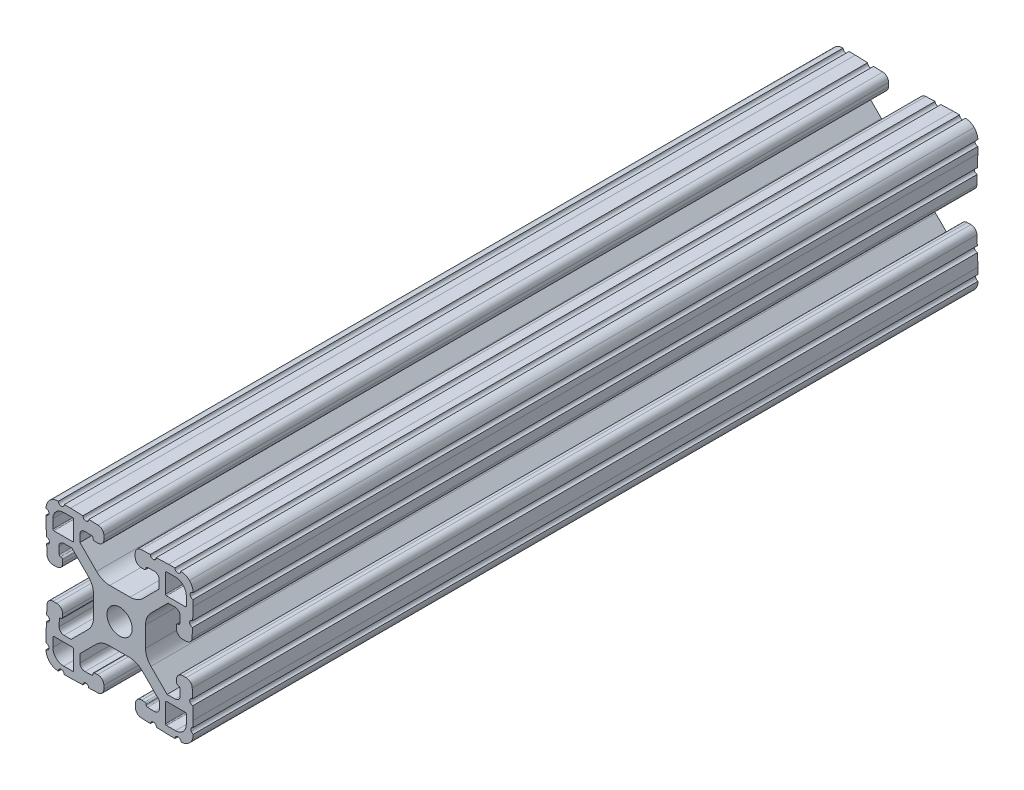
from build123d import *

# Parameters (mm, degrees)
SKETCH1_R           = 3.2639
BOSS_EXTRUDE1_DEPTH = 203.2


with BuildPart() as part:
    # Sketch1 → Boss-Extrude1 (new body)
    with BuildSketch(Plane(origin=(0, 0, -25.4), x_dir=(-1, 0, 0), z_dir=(0, 0, -1))):
        with BuildLine():
            Line((-88.043721549, 91.862643967), (-86.29674679, 91.923648859))
            ThreePointArc((-86.29674679, 91.923648859), (-85.370208675, 91.567983831), (-84.982425017, 90.654422489))
            Line((-84.982425017, 90.654422489), (-84.982425017, 88.800173916))
            Line((-84.982425017, 88.800173916), (-89.306565884, 84.476033049))
            ThreePointArc((-89.306565884, 84.476033049), (-90.866149908, 83.406077005), (-92.719610366, 83.029523439))
            Line((-92.719610366, 83.029523439), (-97.961628589, 83.029523439))
            ThreePointArc((-97.961628589, 83.029523439), (-99.779298356, 83.391080435), (-101.320244378, 84.42070765))
            Line((-101.320244378, 84.42070765), (-105.516001761, 88.616465033))
            Line((-105.516001761, 88.616465033), (-105.516001761, 90.731330035))
            ThreePointArc((-105.516001761, 90.731330035), (-105.128218103, 91.644891377), (-104.201679988, 92.000556406))
            Line((-104.201679988, 92.000556406), (-102.454705229, 91.939551513))
            ThreePointArc((-102.454705229, 91.939551513), (-102.193933359, 91.823448504), (-102.087001761, 91.558783602))
            ThreePointArc((-102.087001761, 91.558783602), (-102.010859042, 91.249291513), (-101.726191901, 91.105946874))
            Line((-101.726191901, 91.105946874), (-100.929727576, 91.078102142))
            ThreePointArc((-100.929727576, 91.078102142), (-99.780779944, 91.519102656), (-99.299905511, 92.651940638))
            Line((-99.299905511, 92.651940638), (-99.299905511, 93.566848638))
            ThreePointArc((-99.299905511, 93.566848638), (-99.741889517, 94.660796975), (-100.819746715, 95.140689345))
            Line((-100.819746715, 95.140689345), (-103.211918901, 95.224224422))
            ThreePointArc((-103.211918901, 95.224224422), (-104.000045777, 94.489281495), (-104.734990687, 95.277406522))
            Line((-104.734990687, 95.277406522), (-107.935905676, 95.389166912))
            Line((-107.935905676, 95.389166912), (-109.561454876, 95.389166912))
            ThreePointArc((-109.561454876, 95.389166912), (-110.323454876, 94.627166912), (-111.085454876, 95.389166912))
            ThreePointArc((-111.085454876, 95.389166912), (-112.308767787, 95.144035599), (-113.343184761, 94.446493225))
            ThreePointArc((-113.343184761, 94.446493225), (-114.04072548, 93.412075135), (-114.285854836, 92.188761832))
            ThreePointArc((-114.285854836, 92.188761832), (-113.523853616, 91.426762441), (-114.285853616, 90.664761832))
            Line((-114.285853616, 90.664761832), (-114.285853616, 89.039212632))
            Line((-114.285853616, 89.039212632), (-114.174093219, 85.838297643))
            ThreePointArc((-114.174093219, 85.838297643), (-113.385968191, 85.103352735), (-114.120911115, 84.315225857))
            Line((-114.120911115, 84.315225857), (-114.037376031, 81.923053667))
            ThreePointArc((-114.037376031, 81.923053667), (-113.55748366, 80.845196472), (-112.463535325, 80.403212468))
            Line((-112.463535325, 80.403212468), (-111.548627325, 80.403212468))
            ThreePointArc((-111.548627325, 80.403212468), (-110.415788905, 80.884087354), (-109.974788872, 82.033035791))
            Line((-109.974788872, 82.033035791), (-110.002634241, 82.829500094))
            ThreePointArc((-110.002634241, 82.829500094), (-110.118742417, 83.090261917), (-110.383401914, 83.197188))
            ThreePointArc((-110.383401914, 83.197188), (-110.693757401, 83.272605688), (-110.837665276, 83.557735272))
            Line((-110.837665276, 83.557735272), (-110.898671566, 85.304709982))
            ThreePointArc((-110.898671566, 85.304709982), (-110.543006925, 86.231248747), (-109.62944523, 86.61903277))
            Line((-109.62944523, 86.61903277), (-107.807161806, 86.61903277))
            Line((-107.807161806, 86.61903277), (-103.364925613, 82.176810793))
            ThreePointArc((-103.364925613, 82.176810793), (-102.335294479, 80.635862907), (-101.973736029, 78.81818963))
            Line((-101.973736029, 78.81818963), (-101.973736029, 73.576034207))
            ThreePointArc((-101.973736029, 73.576034207), (-102.335293752, 71.758362684), (-103.364922926, 70.21741573))
            Line((-103.364922926, 70.21741573), (-107.560683666, 66.021661704))
            Line((-107.560683666, 66.021661704), (-109.652436558, 66.021661704))
            ThreePointArc((-109.652436558, 66.021661704), (-110.565998503, 66.409445617), (-110.921663765, 67.335984343))
            Line((-110.921663765, 67.335984343), (-110.860658873, 69.082959102))
            ThreePointArc((-110.860658873, 69.082959102), (-110.744555864, 69.343730973), (-110.479890961, 69.45066257))
            ThreePointArc((-110.479890961, 69.45066257), (-110.173494703, 69.529390272), (-110.032185196, 69.812424443))
            Line((-110.032185196, 69.812424443), (-110.004340464, 70.608888768))
            ThreePointArc((-110.004340464, 70.608888768), (-110.445340978, 71.7578364), (-111.57817896, 72.238710833))
            Line((-111.57817896, 72.238710833), (-112.49308696, 72.238710833))
            ThreePointArc((-112.49308696, 72.238710833), (-113.587035297, 71.796726827), (-114.066927667, 70.718869629))
            Line((-114.066927667, 70.718869629), (-114.150462744, 68.326697443))
            ThreePointArc((-114.150462744, 68.326697443), (-113.415519817, 67.538570567), (-114.203644843, 66.803625657))
            Line((-114.203644843, 66.803625657), (-114.315405233, 63.602710668))
            Line((-114.315405233, 63.602710668), (-114.315405233, 61.962557497))
            ThreePointArc((-114.315405233, 61.962557497), (-113.701927281, 61.206106537), (-114.333208228, 60.464447842))
            ThreePointArc((-114.333208228, 60.464447842), (-114.113020459, 59.176546471), (-113.392816136, 58.086372941))
            ThreePointArc((-113.392816136, 58.086372941), (-112.358398046, 57.388832223), (-111.135084743, 57.143702867))
            ThreePointArc((-111.135084743, 57.143702867), (-110.373085352, 57.905704086), (-109.611084743, 57.143704086))
            Line((-109.611084743, 57.143704086), (-107.985535543, 57.143704086))
            Line((-107.985535543, 57.143704086), (-104.784620554, 57.255464483))
            ThreePointArc((-104.784620554, 57.255464483), (-104.049675645, 58.04358951), (-103.261548768, 57.308646586))
            Line((-103.261548768, 57.308646586), (-100.869376578, 57.39218167))
            ThreePointArc((-100.869376578, 57.39218167), (-99.791519383, 57.872074041), (-99.349535378, 58.966022376))
            Line((-99.349535378, 58.966022376), (-99.349535378, 59.880930376))
            ThreePointArc((-99.349535378, 59.880930376), (-99.830409811, 61.013768358), (-100.979357443, 61.454768873))
            Line((-100.979357443, 61.454768873), (-101.775821768, 61.42692414))
            ThreePointArc((-101.775821768, 61.42692414), (-102.036583684, 61.310816174), (-102.143509978, 61.046156762))
            ThreePointArc((-102.143509978, 61.046156762), (-102.222494916, 60.740061862), (-102.505377386, 60.598958297))
            Line((-102.505377386, 60.598958297), (-104.252352145, 60.537953405))
            ThreePointArc((-104.252352145, 60.537953405), (-105.17889026, 60.893618433), (-105.566673918, 61.807179775))
            Line((-105.566673918, 61.807179775), (-105.566673918, 63.629462758))
            Line((-105.566673918, 63.629462758), (-101.131142468, 68.064994208))
            ThreePointArc((-101.131142468, 68.064994208), (-99.590196446, 69.094621422), (-97.772526678, 69.456178419))
            Line((-97.772526678, 69.456178419), (-92.530356056, 69.456178419))
            ThreePointArc((-92.530356056, 69.456178419), (-90.712686289, 69.094621422), (-89.171740267, 68.064994208))
            Line((-89.171740267, 68.064994208), (-84.975982884, 63.869236825))
            Line((-84.975982884, 63.869236825), (-84.975982884, 61.781050107))
            ThreePointArc((-84.975982884, 61.781050107), (-85.363766542, 60.867488765), (-86.290304657, 60.511823736))
            Line((-86.290304657, 60.511823736), (-88.037279416, 60.572828629))
            ThreePointArc((-88.037279416, 60.572828629), (-88.298051286, 60.688931638), (-88.404982884, 60.95359654))
            ThreePointArc((-88.404982884, 60.95359654), (-88.466593694, 61.278962759), (-88.759626911, 61.433204782))
            Line((-88.759626911, 61.433204782), (-89.556091237, 61.461049514))
            ThreePointArc((-89.556091237, 61.461049514), (-90.705038868, 61.020049), (-91.185913301, 59.887211018))
            Line((-91.185913301, 59.887211018), (-91.185913301, 58.972303018))
            ThreePointArc((-91.185913301, 58.972303018), (-90.743929295, 57.878354681), (-89.666072098, 57.398462311))
            Line((-89.666072098, 57.398462311), (-87.273899911, 57.314927234))
            ThreePointArc((-87.273899911, 57.314927234), (-86.485773036, 58.049870161), (-85.750828126, 57.261745135))
            Line((-85.750828126, 57.261745135), (-82.549913136, 57.149984745))
            Line((-82.549913136, 57.149984745), (-80.924363936, 57.149984745))
            ThreePointArc((-80.924363936, 57.149984745), (-80.162363936, 57.911984745), (-79.400363936, 57.149984745))
            ThreePointArc((-79.400363936, 57.149984745), (-78.177051025, 57.395116058), (-77.142634052, 58.092658432))
            ThreePointArc((-77.142634052, 58.092658432), (-76.445094372, 59.127074031), (-76.199963977, 60.350384428))
            ThreePointArc((-76.199963977, 60.350384428), (-76.961961268, 61.112385783), (-76.199961268, 61.874384428))
            Line((-76.199961268, 61.874384428), (-76.199961268, 63.499933628))
            Line((-76.199961268, 63.499933628), (-76.311721666, 66.700848617))
            ThreePointArc((-76.311721666, 66.700848617), (-77.099846694, 67.435793525), (-76.364903769, 68.223920403))
            Line((-76.364903769, 68.223920403), (-76.448438853, 70.616092593))
            ThreePointArc((-76.448438853, 70.616092593), (-76.928331225, 71.693949788), (-78.02227956, 72.135933792))
            Line((-78.02227956, 72.135933792), (-78.93718756, 72.135933792))
            ThreePointArc((-78.93718756, 72.135933792), (-80.07002598, 71.655058906), (-80.511026012, 70.506110469))
            Line((-80.511026012, 70.506110469), (-80.483180643, 69.709646166))
            ThreePointArc((-80.483180643, 69.709646166), (-80.367072468, 69.448884343), (-80.102412971, 69.34195826))
            ThreePointArc((-80.102412971, 69.34195826), (-79.796317908, 69.262973649), (-79.655214052, 68.980091239))
            Line((-79.655214052, 68.980091239), (-79.594207761, 67.233116529))
            ThreePointArc((-79.594207761, 67.233116529), (-79.949872402, 66.306577764), (-80.863434097, 65.918793741))
            Line((-80.863434097, 65.918793741), (-82.685717521, 65.918793741))
            Line((-82.685717521, 65.918793741), (-87.121258001, 70.35431293))
            ThreePointArc((-87.121258001, 70.35431293), (-88.150863946, 71.895196205), (-88.512450271, 73.712794894))
            Line((-88.512450271, 73.712794894), (-88.512606864, 78.954950317))
            ThreePointArc((-88.512606864, 78.954950317), (-88.151076291, 80.772698182), (-87.121419968, 82.313710679))
            Line((-87.121419968, 82.313710679), (-82.925659228, 86.509464706))
            Line((-82.925659228, 86.509464706), (-80.837473527, 86.509464706))
            ThreePointArc((-80.837473527, 86.509464706), (-79.923911584, 86.121680793), (-79.568246321, 85.195142068))
            Line((-79.568246321, 85.195142068), (-79.629251214, 83.448167309))
            ThreePointArc((-79.629251214, 83.448167309), (-79.745354223, 83.187395438), (-80.010019125, 83.080463841))
            ThreePointArc((-80.010019125, 83.080463841), (-80.335385344, 83.018853031), (-80.489627367, 82.725819813))
            Line((-80.489627367, 82.725819813), (-80.5174721, 81.929355488))
            ThreePointArc((-80.5174721, 81.929355488), (-80.076471586, 80.780407856), (-78.943633603, 80.299533423))
            Line((-78.943633603, 80.299533423), (-78.028725603, 80.299533423))
            ThreePointArc((-78.028725603, 80.299533423), (-76.934777267, 80.741517429), (-76.454884897, 81.819374627))
            Line((-76.454884897, 81.819374627), (-76.37134982, 84.211546813))
            ThreePointArc((-76.37134982, 84.211546813), (-77.106292747, 84.999673689), (-76.31816772, 85.734618599))
            Line((-76.31816772, 85.734618599), (-76.20640733, 88.935533588))
            Line((-76.20640733, 88.935533588), (-76.20640733, 90.561082788))
            ThreePointArc((-76.20640733, 90.561082788), (-76.96840733, 91.323083398), (-76.206406111, 92.085082788))
            ThreePointArc((-76.206406111, 92.085082788), (-76.451535467, 93.308396091), (-77.149076185, 94.342814181))
            ThreePointArc((-77.149076185, 94.342814181), (-78.183493159, 95.040356555), (-79.40680607, 95.285487868))
            ThreePointArc((-79.40680607, 95.285487868), (-80.16880607, 94.523487868), (-80.93080607, 95.285487868))
            Line((-80.93080607, 95.285487868), (-82.55635527, 95.285487868))
            Line((-82.55635527, 95.285487868), (-85.757270259, 95.173727471))
            ThreePointArc((-85.757270259, 95.173727471), (-86.492215168, 94.385602444), (-87.280342045, 95.120545368))
            Line((-87.280342045, 95.120545368), (-89.672514235, 95.037010285))
            ThreePointArc((-89.672514235, 95.037010285), (-90.75037143, 94.557117913), (-91.192355435, 93.463169578))
            Line((-91.192355435, 93.463169578), (-91.192355435, 92.548261578))
            ThreePointArc((-91.192355435, 92.548261578), (-90.711481002, 91.415423596), (-89.56253337, 90.974423082))
            Line((-89.56253337, 90.974423082), (-88.766069045, 91.002267814))
            ThreePointArc((-88.766069045, 91.002267814), (-88.505307129, 91.11837578), (-88.398380835, 91.383035192))
            ThreePointArc((-88.398380835, 91.383035192), (-88.336765486, 91.708407548), (-88.043721549, 91.862643967))
        make_face()
        with Locations(Location((-95.25, 76.2, 0), (0, 0, 180))):
            Circle(SKETCH1_R, mode=Mode.SUBTRACT)
        with BuildLine():
            Line((-83.357745393, 88.294108398), (-83.357745393, 93.170908398))
            ThreePointArc((-83.357745393, 93.170908398), (-83.283351492, 93.350512545), (-83.103748154, 93.424908398))
            Line((-83.103748154, 93.424908398), (-80.766975763, 93.424933798))
            ThreePointArc((-80.766975763, 93.424933798), (-78.791299784, 92.606600882), (-77.972945393, 90.630933798))
            Line((-77.972945393, 90.630933798), (-77.972945393, 88.294108398))
            ThreePointArc((-77.972945393, 88.294108398), (-78.047340271, 88.114503276), (-78.226945393, 88.040108398))
            Line((-78.226945393, 88.040108398), (-83.103745393, 88.040108398))
            ThreePointArc((-83.103745393, 88.040108398), (-83.283350516, 88.114503276), (-83.357745393, 88.294108398))
        make_face(mode=Mode.SUBTRACT)
        with BuildLine():
            Line((-83.357745393, 59.229091602), (-83.357745393, 64.105891602))
            ThreePointArc((-83.357745393, 64.105891602), (-83.283350516, 64.285496724), (-83.103745393, 64.359891602))
            Line((-83.103745393, 64.359891602), (-78.226945393, 64.359891602))
            ThreePointArc((-78.226945393, 64.359891602), (-78.047340271, 64.285496724), (-77.972945393, 64.105891602))
            Line((-77.972945393, 64.105891602), (-77.972945393, 61.769066202))
            ThreePointArc((-77.972945393, 61.769066202), (-78.791299784, 59.793399118), (-80.766975763, 58.975066202))
            Line((-80.766975763, 58.975066202), (-83.103748154, 58.975091602))
            ThreePointArc((-83.103748154, 58.975091602), (-83.283351492, 59.049487455), (-83.357745393, 59.229091602))
        make_face(mode=Mode.SUBTRACT)
        with BuildLine():
            Line((-107.142254607, 93.170908398), (-107.142254607, 88.294108398))
            ThreePointArc((-107.142254607, 88.294108398), (-107.216649484, 88.114503276), (-107.396254607, 88.040108398))
            Line((-107.396254607, 88.040108398), (-112.273054607, 88.040108398))
            ThreePointArc((-112.273054607, 88.040108398), (-112.452659729, 88.114503276), (-112.527054607, 88.294108398))
            Line((-112.527054607, 88.294108398), (-112.527054607, 90.630933798))
            ThreePointArc((-112.527054607, 90.630933798), (-111.708700216, 92.606600882), (-109.733024237, 93.424933798))
            Line((-109.733024237, 93.424933798), (-107.396251846, 93.424908398))
            ThreePointArc((-107.396251846, 93.424908398), (-107.216648508, 93.350512545), (-107.142254607, 93.170908398))
        make_face(mode=Mode.SUBTRACT)
        with BuildLine():
            Line((-107.142254607, 64.105891602), (-107.142254607, 59.229091602))
            ThreePointArc((-107.142254607, 59.229091602), (-107.216648508, 59.049487455), (-107.396251846, 58.975091602))
            Line((-107.396251846, 58.975091602), (-109.733024237, 58.975066202))
            ThreePointArc((-109.733024237, 58.975066202), (-111.708700216, 59.793399118), (-112.527054607, 61.769066202))
            Line((-112.527054607, 61.769066202), (-112.527054607, 64.105891602))
            ThreePointArc((-112.527054607, 64.105891602), (-112.452659729, 64.285496724), (-112.273054607, 64.359891602))
            Line((-112.273054607, 64.359891602), (-107.396254607, 64.359891602))
            ThreePointArc((-107.396254607, 64.359891602), (-107.216649484, 64.285496724), (-107.142254607, 64.105891602))
        make_face(mode=Mode.SUBTRACT)
    extrude(amount=-BOSS_EXTRUDE1_DEPTH)


solid = part.part
